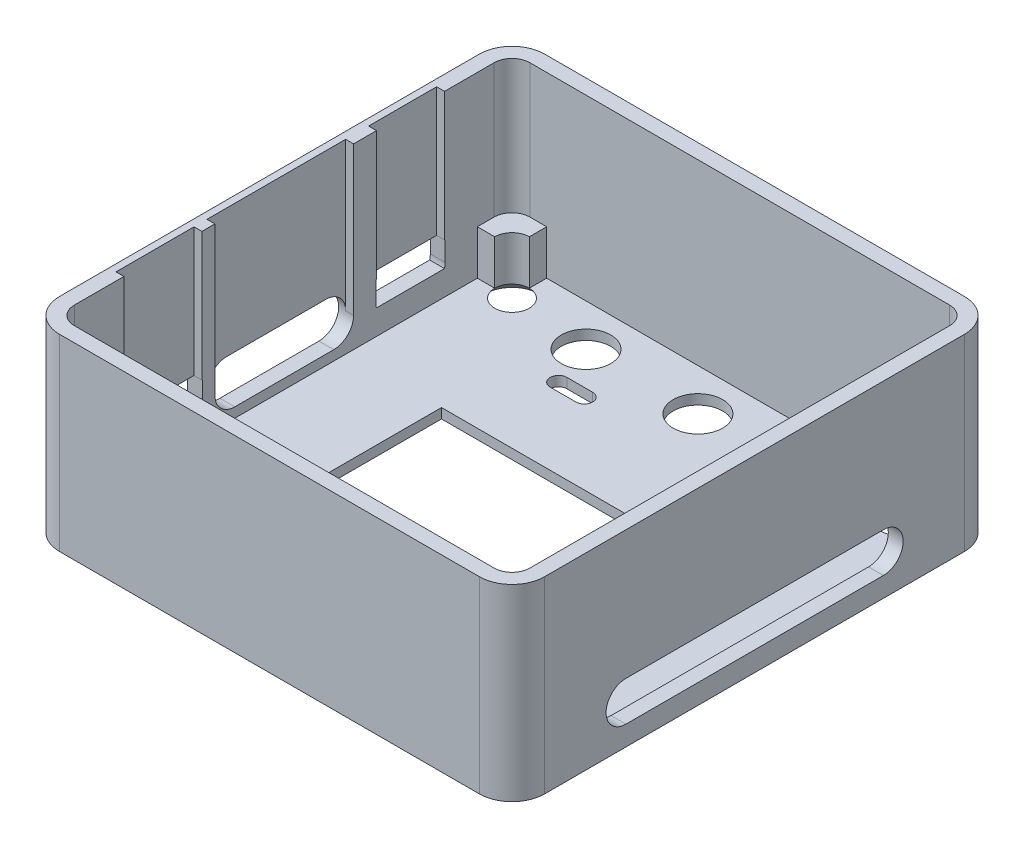
from build123d import *

# Parameters (mm, degrees)
EXTRUDE_1_DEPTH                = 19
SKETCH_1_3_R                   = 1.75
EXTRUDE_1_2_DEPTH              = 1
HOLE_WIZARD_M2_5_1_D           = 3.1
HOLE_WIZARD_M2_5_1_DEPTH       = 10
HOLE_WIZARD_M2_5_1_CSINK_D     = 5.5
HOLE_WIZARD_M2_5_1_CSINK_ANGLE = 90
HOLE_WIZARD_M2_5_1_TIP         = 0.931333959
SKETCH_4_R                     = 2.5
SKETCH_4_R_2                   = 1.75
SKETCH_4_W                     = 27
SKETCH_4_H                     = 26.512923835
CUT_EXTRUDE_1_DEPTH            = 143
CUT_EXTRUDE_2_DEPTH            = 21
CUT_EXTRUDE_4_DEPTH            = 27
EXTRUDE_2_DEPTH                = 4.5
CUT_EXTRUDE_START              = -0.8
SKETCH_9_W                     = 7.872983346
SKETCH_9_H                     = 13
SKETCH_9_W_2                   = 6.872983346
CUT_EXTRUDE_5_DEPTH            = 0.8


with BuildPart() as part:
    # 草图1 → Extrude 1 (new body)
    with BuildSketch(Plane(origin=(0, 0, 0), x_dir=(1, 0, 0), z_dir=(0, 1, 0))):
        with BuildLine():
            Line((-24.5, 21.2), (-24.5, -21.2))
            ThreePointArc((-24.5, -21.2), (-23.533452378, -23.533452378), (-21.2, -24.5))
            Line((-21.2, -24.5), (21.2, -24.5))
            ThreePointArc((21.2, -24.5), (23.533452378, -23.533452378), (24.5, -21.2))
            Line((24.5, -21.2), (24.5, 21.2))
            ThreePointArc((24.5, 21.2), (23.533452378, 23.533452378), (21.2, 24.5))
            Line((21.2, 24.5), (-21.2, 24.5))
            ThreePointArc((-21.2, 24.5), (-23.533452378, 23.533452378), (-24.5, 21.2))
        make_face()
        with BuildLine():
            Line((-23, 21.2), (-23, -21.2))
            ThreePointArc((-23, -21.2), (-22.472792206, -22.472792206), (-21.2, -23))
            Line((-21.2, -23), (21.2, -23))
            ThreePointArc((21.2, -23), (22.472792206, -22.472792206), (23, -21.2))
            Line((23, -21.2), (23, 21.2))
            ThreePointArc((23, 21.2), (22.472792206, 22.472792206), (21.2, 23))
            Line((21.2, 23), (-21.2, 23))
            ThreePointArc((-21.2, 23), (-22.472792206, 22.472792206), (-23, 21.2))
        make_face(mode=Mode.SUBTRACT)
    extrude(amount=EXTRUDE_1_DEPTH)

    # 草图1<3> → Extrude 1 2 (add)
    with BuildSketch(Plane(origin=(0, 0, 0), x_dir=(1, 0, 0), z_dir=(0, 1, 0))):
        with BuildLine():
            Line((-21.2, -23), (21.2, -23))
            ThreePointArc((21.2, -23), (22.472792206, -22.472792206), (23, -21.2))
            Line((23, -21.2), (23, 21.2))
            ThreePointArc((23, 21.2), (22.472792206, 22.472792206), (21.2, 23))
            Line((21.2, 23), (-21.2, 23))
            ThreePointArc((-21.2, 23), (-22.472792206, 22.472792206), (-23, 21.2))
            Line((-23, 21.2), (-23, -21.2))
            ThreePointArc((-23, -21.2), (-22.472792206, -22.472792206), (-21.2, -23))
        make_face()
        with Locations(Location((-19.5, 19.5, 0), (0, 0, 270))):
            Circle(SKETCH_1_3_R, mode=Mode.SUBTRACT)
        with Locations(Location((19.5, 19.5, 0), (0, 0, 270))):
            Circle(SKETCH_1_3_R, mode=Mode.SUBTRACT)
        with Locations(Location((19.5, -19.5, 0), (0, 0, 270))):
            Circle(SKETCH_1_3_R, mode=Mode.SUBTRACT)
        with Locations(Location((-19.5, -19.5, 0), (0, 0, 270))):
            Circle(SKETCH_1_3_R, mode=Mode.SUBTRACT)
    extrude(amount=EXTRUDE_1_2_DEPTH)

    # M2.5 平头机械螺钉的锥形沉头孔1
    with Locations(Plane(origin=(-19.5, 0, 19.5), x_dir=(0, 0, -1), z_dir=(0, -1, 0))):
        with Locations((0, 0), (0, 39), (39, 39), (39, 0)):
            CounterSinkHole(HOLE_WIZARD_M2_5_1_D / 2, HOLE_WIZARD_M2_5_1_CSINK_D / 2, depth=HOLE_WIZARD_M2_5_1_DEPTH, counter_sink_angle=HOLE_WIZARD_M2_5_1_CSINK_ANGLE)
            with Locations((0, 0, -(HOLE_WIZARD_M2_5_1_DEPTH + HOLE_WIZARD_M2_5_1_TIP / 2))):  # 118° drill point
                Cone(0, HOLE_WIZARD_M2_5_1_D / 2, HOLE_WIZARD_M2_5_1_TIP, mode=Mode.SUBTRACT)

    # 草图4 → 切除-拉伸1 (cut)
    with BuildSketch(Plane.XZ):
        with Locations(Location((-11.3, -18.775, 0), (0, 0, 270))):
            Circle(SKETCH_4_R)
        with Locations(Location((0, -18.775, 0), (0, 0, 270))):
            Circle(SKETCH_4_R)
        with Locations(Location((12.3, -18.775, 0), (0, 0, 270))):
            Circle(SKETCH_4_R)
        with Locations((-19.5, -19.5)):
            Circle(SKETCH_4_R_2)
        with Locations((0, 6.876225995)):
            Rectangle(SKETCH_4_W, SKETCH_4_H)
        with BuildLine():
            Line((7.2, -13.65), (9.8, -13.65))
            ThreePointArc((9.8, -13.65), (10.65, -14.5), (9.8, -15.35))
            Line((9.8, -15.35), (7.2, -15.35))
            ThreePointArc((7.2, -15.35), (6.35, -14.5), (7.2, -13.65))
        make_face()
        with BuildLine():
            Line((-9.8, -13.65), (-7.2, -13.65))
            ThreePointArc((-7.2, -13.65), (-6.35, -14.5), (-7.2, -15.35))
            Line((-7.2, -15.35), (-9.8, -15.35))
            ThreePointArc((-9.8, -15.35), (-10.65, -14.5), (-9.8, -13.65))
        make_face()
    extrude(amount=-CUT_EXTRUDE_1_DEPTH, mode=Mode.SUBTRACT)

    # 草图5 → 切除-拉伸2 (cut)
    with BuildSketch(Plane.ZY.offset(24.5)):
        with BuildLine():
            Line((-16.186491673, 3.5), (-9.313508327, 3.5))
            ThreePointArc((-9.313508327, 3.5), (-9.265940607, 3.747991415), (-9.25, 4))
            ThreePointArc((-9.25, 4), (-9.835786438, 5.414213562), (-11.25, 6))
            Line((-11.25, 6), (-14.25, 6))
            ThreePointArc((-14.25, 6), (-15.664213562, 5.414213562), (-16.25, 4))
            ThreePointArc((-16.25, 4), (-16.234059393, 3.747991415), (-16.186491673, 3.5))
        make_face()
        with BuildLine():
            Line((-6.936491673, 3.5), (6.936491673, 3.5))
            ThreePointArc((6.936491673, 3.5), (6.58113883, 5.224744871), (5, 6))
            Line((5, 6), (-5, 6))
            ThreePointArc((-5, 6), (-6.58113883, 5.224744871), (-6.936491673, 3.5))
        make_face()
        with BuildLine():
            Line((-5, 2), (5, 2))
            ThreePointArc((5, 2), (6.224744871, 2.41886117), (6.936491673, 3.5))
            Line((6.936491673, 3.5), (-6.936491673, 3.5))
            ThreePointArc((-6.936491673, 3.5), (-6.224744871, 2.41886117), (-5, 2))
        make_face()
        with BuildLine():
            Line((8.313508327, 3.5), (16.186491673, 3.5))
            ThreePointArc((16.186491673, 3.5), (16.234059393, 3.747991415), (16.25, 4))
            ThreePointArc((16.25, 4), (15.664213562, 5.414213562), (14.25, 6))
            Line((14.25, 6), (10.25, 6))
            ThreePointArc((10.25, 6), (8.835786438, 5.414213562), (8.25, 4))
            ThreePointArc((8.25, 4), (8.265940607, 3.747991415), (8.313508327, 3.5))
        make_face()
        with BuildLine():
            Line((-16.25, 6), (-16.25, 4))
            ThreePointArc((-16.25, 4), (-15.664213562, 5.414213562), (-14.25, 6))
            Line((-14.25, 6), (-16.25, 6))
        make_face()
        with BuildLine():
            ThreePointArc((14.25, 6), (15.664213562, 5.414213562), (16.25, 4))
            Line((16.25, 4), (16.25, 6))
            Line((16.25, 6), (14.25, 6))
        make_face()
        with BuildLine():
            ThreePointArc((-11.25, 6), (-9.835786438, 5.414213562), (-9.25, 4))
            Line((-9.25, 4), (-9.25, 6))
            Line((-9.25, 6), (-11.25, 6))
        make_face()
        with BuildLine():
            Line((8.25, 6), (8.25, 4))
            ThreePointArc((8.25, 4), (8.835786438, 5.414213562), (10.25, 6))
            Line((10.25, 6), (8.25, 6))
        make_face()
    extrude(amount=-CUT_EXTRUDE_2_DEPTH, mode=Mode.SUBTRACT)

    # 草图7 → 切除-拉伸4 (cut)
    with BuildSketch(Plane(origin=(24.5, 0, 0), x_dir=(0, 0, -1), z_dir=(1, 0, 0))):
        with BuildLine():
            Line((-13, 6), (13, 6))
            ThreePointArc((13, 6), (15, 4), (13, 2))
            Line((13, 2), (-13, 2))
            ThreePointArc((-13, 2), (-15, 4), (-13, 6))
        make_face()
    extrude(amount=-CUT_EXTRUDE_4_DEPTH, mode=Mode.SUBTRACT)

    # 草图8 → 凸台-拉伸2 (add)
    with BuildSketch(Plane(origin=(0, 1, 0), x_dir=(1, 0, 0), z_dir=(0, 1, 0))):
        with BuildLine():
            Line((-23, 19.5), (-21.25, 19.5))
            ThreePointArc((-21.25, 19.5), (-20.737436867, 20.737436867), (-19.5, 21.25))
            Line((-19.5, 21.25), (-19.5, 23))
            Line((-19.5, 23), (-21.2, 23))
            ThreePointArc((-21.2, 23), (-22.472792206, 22.472792206), (-23, 21.2))
            Line((-23, 21.2), (-23, 19.5))
        make_face()
        with BuildLine():
            Line((-21.25, -19.5), (-23, -19.5))
            Line((-23, -19.5), (-23, -21.2))
            ThreePointArc((-23, -21.2), (-22.472792206, -22.472792206), (-21.2, -23))
            Line((-21.2, -23), (-19.5, -23))
            Line((-19.5, -23), (-19.5, -21.25))
            ThreePointArc((-19.5, -21.25), (-20.737436867, -20.737436867), (-21.25, -19.5))
        make_face()
        with BuildLine():
            Line((19.5, -21.25), (19.5, -23))
            Line((19.5, -23), (21.2, -23))
            ThreePointArc((21.2, -23), (22.472792206, -22.472792206), (23, -21.2))
            Line((23, -21.2), (23, -19.5))
            Line((23, -19.5), (21.25, -19.5))
            ThreePointArc((21.25, -19.5), (20.737436867, -20.737436867), (19.5, -21.25))
        make_face()
        with BuildLine():
            Line((21.2, 23), (19.5, 23))
            Line((19.5, 23), (19.5, 21.25))
            ThreePointArc((19.5, 21.25), (20.737436867, 20.737436867), (21.25, 19.5))
            Line((21.25, 19.5), (23, 19.5))
            Line((23, 19.5), (23, 21.2))
            ThreePointArc((23, 21.2), (22.472792206, 22.472792206), (21.2, 23))
        make_face()
    extrude(amount=EXTRUDE_2_DEPTH)

    # 草图9 → 切除-拉伸5 (cut)
    with BuildSketch(Plane(origin=(-23, 0, 0), x_dir=(0, 0, -1), z_dir=(1, 0, 0)).offset(CUT_EXTRUDE_START)):
        with BuildLine():
            Line((-7, 19), (-7, 4))
            ThreePointArc((-7, 4), (-6.414213562, 5.414213562), (-5, 6))
            Line((-5, 6), (5, 6))
            ThreePointArc((5, 6), (6.414213562, 5.414213562), (7, 4))
            Line((7, 4), (7, 19))
            Line((7, 19), (-7, 19))
        make_face()
        with Locations((-12.25, 12.5)):
            Rectangle(SKETCH_9_W, SKETCH_9_H)
        with Locations((12.75, 12.5)):
            Rectangle(SKETCH_9_W_2, SKETCH_9_H)
    extrude(amount=CUT_EXTRUDE_5_DEPTH, mode=Mode.SUBTRACT)


solid = part.part
